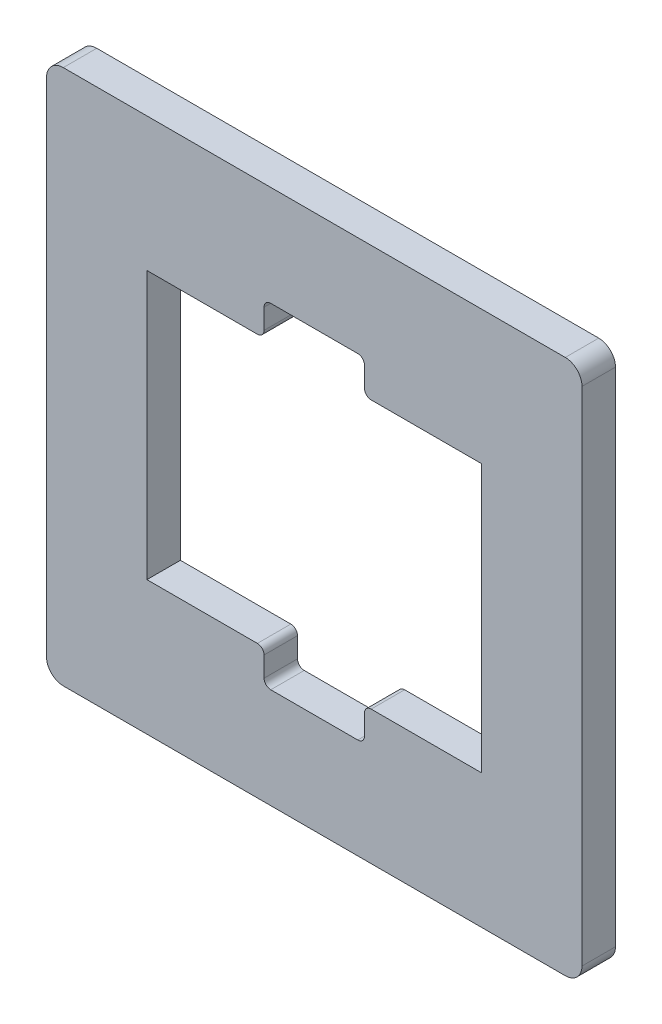
from build123d import *

# Parameters (mm, degrees)
MAINBODYS_W     = 16
MAINBODYS_H     = 16
MAIN_BODY_DEPTH = 1
MIDCUTS_W       = 10
MIDCUTS_H       = 8
MID_CUT_DEPTH   = 12.357816692
GROUNDCUTS_W    = 3
GROUNDCUTS_H    = 1
GROUNDCUT_DEPTH = 12.357816692
OUTER_FILLETS_R = 0.5
GCF_R           = 0.2


with BuildPart() as part:
    # MainBodyS → MAIN BODY (new body)
    with BuildSketch(Plane.XY):
        Rectangle(MAINBODYS_W, MAINBODYS_H)
    extrude(amount=-MAIN_BODY_DEPTH)

    # MidCutS → MID CUT (cut, through all)
    with BuildSketch(Plane.XY):
        Rectangle(MIDCUTS_W, MIDCUTS_H)
    extrude(amount=-MID_CUT_DEPTH, mode=Mode.SUBTRACT)

    # GroundCutS → GroundCut (cut, through all)
    with BuildSketch(Plane.XY):
        with Locations((0, 4.5)):
            Rectangle(GROUNDCUTS_W, GROUNDCUTS_H)
    groundcut = extrude(amount=-GROUNDCUT_DEPTH, mode=Mode.SUBTRACT)

    # GCVM: GroundCut across plane
    add(groundcut.mirror(Plane.ZX), mode=Mode.SUBTRACT)

    # OUTER FILLETS
    outer_fillets_edges = [part.edges().sort_by_distance(p)[0] for p in [
        (8, -8, -0.5),
        (-8, -8, -0.5),
        (-8, 8, -0.5),
        (8, 8, -0.5),
    ]]
    fillet(outer_fillets_edges, radius=OUTER_FILLETS_R)

    # GCF
    gcf_edges = [part.edges().sort_by_distance(p)[0] for p in [
        (1.5, 5, -0.5),
        (1.5, 4, -0.5),
        (-1.5, 4, -0.5),
        (-1.5, 5, -0.5),
        (1.5, -4, -0.5),
        (1.5, -5, -0.5),
        (-1.5, -5, -0.5),
        (-1.5, -4, -0.5),
    ]]
    fillet(gcf_edges, radius=GCF_R)


solid = part.part
